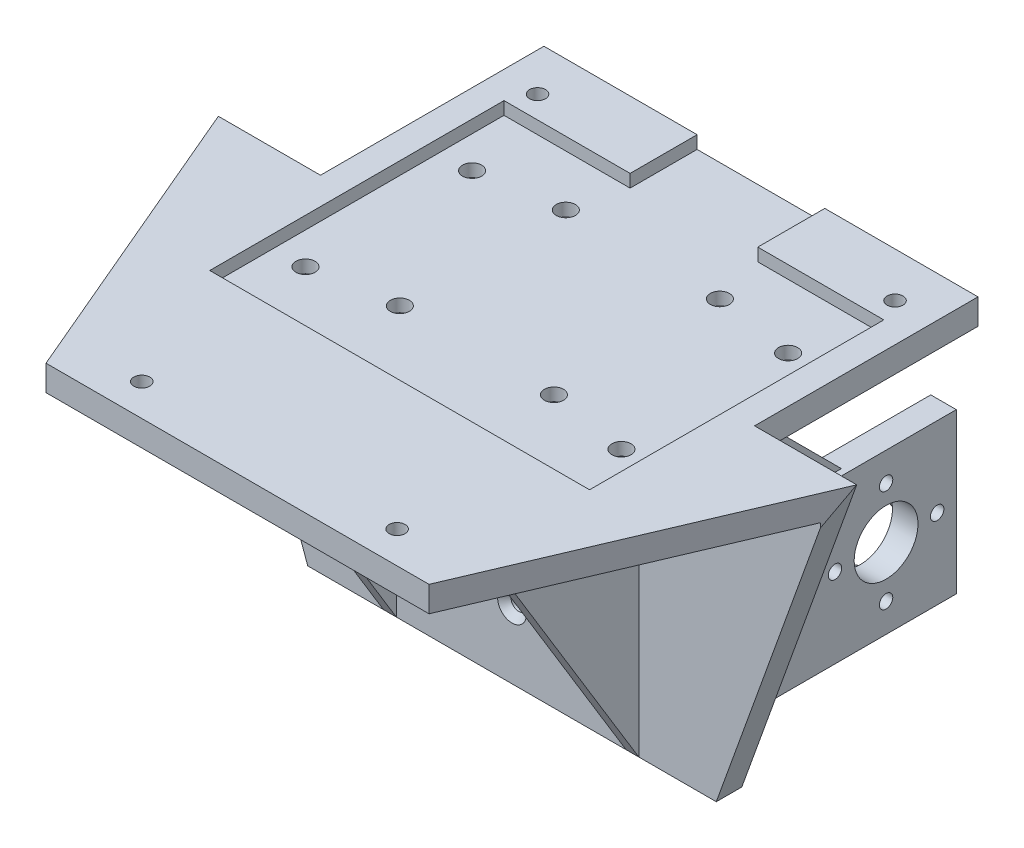
from build123d import *

# Parameters (mm, degrees)
SKETCH_1_W                = 47
SKETCH_1_H                = 50
EXTRUDE_1_DEPTH           = 100
SKETCH_2_W                = 43
SKETCH_2_H                = 46
CUT_EXTRUDE_1_DEPTH       = 122.280666225
HOLE_WIZARD_1_D           = 2.4
HOLE_WIZARD_1_CSINK_D     = 4.5
HOLE_WIZARD_1_CSINK_ANGLE = 90
SKETCH_31_W               = 4
SKETCH_31_H               = 25
EXTRUDE_4_DEPTH           = 37
SKETCH_32_R               = 5
CUT_EXTRUDE_2_DEPTH       = 4
SKETCH_33_R               = 1.9
EXTRUDE_5_DEPTH           = 1.6
SKETCH_34_R               = 1.05
CUT_EXTRUDE_3_DEPTH       = 101.189819842
SKETCH_35_W               = 68
SKETCH_35_H               = 4
EXTRUDE_6_DEPTH           = 35
CUT_EXTRUDE_4_REACH       = 123.281
SKETCH_36_R               = 1.25
CUT_EXTRUDE_5_REACH       = 123.281
CUT_EXTRUDE_6_REACH       = 123.281
SKETCH_39_R               = 2.5
CUT_EXTRUDE_7_DEPTH       = 1.5
CUT_EXTRUDE_8_DEPTH       = 2
CUT_EXTRUDE_9_REACH       = 122.47
SKETCH_41_R               = 1.5
SKETCH_42_R               = 1.5
CUT_EXTRUDE_10_DEPTH      = 2
RIB_2_REACH               = 99.933
SKETCH_46_WALL_W          = 251.717080448
SKETCH_46_WALL_H          = 2
RIB_3_REACH               = 100.118
SKETCH_47_WALL_W          = 252.08841221
SKETCH_47_WALL_H          = 2
SKETCH_48_W               = 2
SKETCH_48_H               = 15
EXTRUDE_7_DEPTH           = 20
CUT_EXTRUDE_11_REACH      = 105.589


with BuildPart() as part:
    # 草图1 → 凸台-拉伸1 (new body)
    with BuildSketch(Plane(origin=(0, 0, 0), x_dir=(0, 0, -1), z_dir=(1, 0, 0))):
        with Locations((-23.5, 25)):
            Rectangle(SKETCH_1_W, SKETCH_1_H)
    extrude(amount=-EXTRUDE_1_DEPTH)

    # 草图2 → 切除-拉伸1 (cut, through all)
    with BuildSketch(Plane(origin=(0, 0, 0), x_dir=(0, 0, -1), z_dir=(1, 0, 0))):
        with Locations((-25.5, 23)):
            Rectangle(SKETCH_2_W, SKETCH_2_H)
    extrude(amount=-CUT_EXTRUDE_1_DEPTH, mode=Mode.SUBTRACT)

    # 打孔尺寸(%根据十字)槽沉头木螺钉的类型1 (through all)
    with Locations(Plane.XY.offset(4)):
        with Locations((-58, 26.5), (-50, 26.5), (-58, 18.5), (-50, 18.5), (-58, 10.5), (-50, 10.5), (-42, 10.5), (-42, 18.5), (-42, 26.5)):
            CounterSinkHole(HOLE_WIZARD_1_D / 2, HOLE_WIZARD_1_CSINK_D / 2, counter_sink_angle=HOLE_WIZARD_1_CSINK_ANGLE)

    # 草图31 → 凸台-拉伸4 (add)
    with BuildSketch(Plane(origin=(0, 0, 0), x_dir=(-1, 0, 0), z_dir=(0, 0, -1))):
        with Locations((23.4, 18.5)):
            Rectangle(SKETCH_31_W, SKETCH_31_H)
    extrude(amount=EXTRUDE_4_DEPTH)

    # 草图32 → 切除-拉伸2 (cut)
    with BuildSketch(Plane.ZY.offset(25.4)):
        with Locations((-26, 18.5)):
            Circle(SKETCH_32_R)
    extrude(amount=-CUT_EXTRUDE_2_DEPTH, mode=Mode.SUBTRACT)

    # 草图33 → 凸台-拉伸5 (add)
    with BuildSketch(Plane.ZY.offset(25.4)):
        with Locations(Location((-26, 26.5, 0), (0, 0, 180))):
            Circle(SKETCH_33_R)
        with Locations(Location((-18, 18.5, 0), (0, 0, 180))):
            Circle(SKETCH_33_R)
        with Locations(Location((-26, 10.5, 0), (0, 0, 180))):
            Circle(SKETCH_33_R)
        with Locations(Location((-34, 18.5, 0), (0, 0, 180))):
            Circle(SKETCH_33_R)
    extrude(amount=EXTRUDE_5_DEPTH)

    # 草图34 → 切除-拉伸3 (cut, through all)
    with BuildSketch(Plane.ZY.offset(27)):
        with Locations((-26, 26.5)):
            Circle(SKETCH_34_R)
        with Locations((-18, 18.5)):
            Circle(SKETCH_34_R)
        with Locations((-26, 10.5)):
            Circle(SKETCH_34_R)
        with Locations((-34, 18.5)):
            Circle(SKETCH_34_R)
    extrude(amount=-CUT_EXTRUDE_3_DEPTH, mode=Mode.SUBTRACT)

    # 草图35 → 凸台-拉伸6 (add)
    with BuildSketch(Plane(origin=(0, 0, 0), x_dir=(-1, 0, 0), z_dir=(0, 0, -1))):
        with Locations((50, 48)):
            Rectangle(SKETCH_35_W, SKETCH_35_H)
    extrude(amount=EXTRUDE_6_DEPTH)

    # 草图36 → 切除-拉伸4 (cut, up to next)
    with BuildSketch(Plane(origin=(0, 50, 0), x_dir=(1, 0, 0), z_dir=(0, 1, 0)), mode=Mode.PRIVATE) as cut_extrude_4_sk1:
        with Locations(Location((-78, 28, 0), (0, 0, 270))):
            Circle(SKETCH_36_R)
    cut_extrude_4_tool1 = extrude(cut_extrude_4_sk1.sketch, amount=-CUT_EXTRUDE_4_REACH, mode=Mode.PRIVATE) & part.part
    # 草图36 → 切除-拉伸4 (cut, up to next)
    with BuildSketch(Plane(origin=(0, 50, 0), x_dir=(1, 0, 0), z_dir=(0, 1, 0)), mode=Mode.PRIVATE) as cut_extrude_4_sk2:
        with Locations(Location((-22, 28, 0), (0, 0, 270))):
            Circle(SKETCH_36_R)
    cut_extrude_4_tool2 = extrude(cut_extrude_4_sk2.sketch, amount=-CUT_EXTRUDE_4_REACH, mode=Mode.PRIVATE) & part.part
    # 草图36 → 切除-拉伸4 (cut, up to next)
    with BuildSketch(Plane(origin=(0, 50, 0), x_dir=(1, 0, 0), z_dir=(0, 1, 0)), mode=Mode.PRIVATE) as cut_extrude_4_sk3:
        with Locations(Location((-70, -42, 0), (0, 0, 270))):
            Circle(SKETCH_36_R)
    cut_extrude_4_tool3 = extrude(cut_extrude_4_sk3.sketch, amount=-CUT_EXTRUDE_4_REACH, mode=Mode.PRIVATE) & part.part
    # 草图36 → 切除-拉伸4 (cut, up to next)
    with BuildSketch(Plane(origin=(0, 50, 0), x_dir=(1, 0, 0), z_dir=(0, 1, 0)), mode=Mode.PRIVATE) as cut_extrude_4_sk4:
        with Locations(Location((-30, -42, 0), (0, 0, 270))):
            Circle(SKETCH_36_R)
    cut_extrude_4_tool4 = extrude(cut_extrude_4_sk4.sketch, amount=-CUT_EXTRUDE_4_REACH, mode=Mode.PRIVATE) & part.part
    add(cut_extrude_4_tool1.solids().sort_by_distance((-78, 50, -28))[0], mode=Mode.SUBTRACT)
    add(cut_extrude_4_tool2.solids().sort_by_distance((-22, 50, -28))[0], mode=Mode.SUBTRACT)
    add(cut_extrude_4_tool3.solids().sort_by_distance((-70, 50, 42))[0], mode=Mode.SUBTRACT)
    add(cut_extrude_4_tool4.solids().sort_by_distance((-30, 50, 42))[0], mode=Mode.SUBTRACT)

    # 草图37 → 切除-拉伸5 (cut, up to next)
    with BuildSketch(Plane(origin=(0, 50, 0), x_dir=(1, 0, 0), z_dir=(0, 1, 0)), mode=Mode.PRIVATE) as cut_extrude_5_sk1:
        Polygon((-100, -47), (-80, -47), (-100, 0), align=None)
    cut_extrude_5_tool1 = extrude(cut_extrude_5_sk1.sketch, amount=-CUT_EXTRUDE_5_REACH, mode=Mode.PRIVATE) & part.part
    # 草图37 → 切除-拉伸5 (cut, up to next)
    with BuildSketch(Plane(origin=(0, 50, 0), x_dir=(1, 0, 0), z_dir=(0, 1, 0)), mode=Mode.PRIVATE) as cut_extrude_5_sk2:
        Polygon((0, -47), (-20, -47), (0, 0), align=None)
    cut_extrude_5_tool2 = extrude(cut_extrude_5_sk2.sketch, amount=-CUT_EXTRUDE_5_REACH, mode=Mode.PRIVATE) & part.part
    add(cut_extrude_5_tool1.solids().sort_by_distance((-93.333333, 50, 31.333333))[0], mode=Mode.SUBTRACT)
    add(cut_extrude_5_tool2.solids().sort_by_distance((-6.666667, 50, 31.333333))[0], mode=Mode.SUBTRACT)

    # 草图38 → 切除-拉伸6 (cut, up to next)
    with BuildSketch(Plane(origin=(0, 0, 0), x_dir=(-1, 0, 0), z_dir=(0, 0, -1)), mode=Mode.PRIVATE) as cut_extrude_6_sk1:
        Polygon((0, 0), (18, 0), (0, 50), align=None)
    cut_extrude_6_tool1 = extrude(cut_extrude_6_sk1.sketch, amount=-CUT_EXTRUDE_6_REACH, mode=Mode.PRIVATE) & part.part
    # 草图38 → 切除-拉伸6 (cut, up to next)
    with BuildSketch(Plane(origin=(0, 0, 0), x_dir=(-1, 0, 0), z_dir=(0, 0, -1)), mode=Mode.PRIVATE) as cut_extrude_6_sk2:
        Polygon((100, 0), (82, 0), (100, 50), align=None)
    cut_extrude_6_tool2 = extrude(cut_extrude_6_sk2.sketch, amount=-CUT_EXTRUDE_6_REACH, mode=Mode.PRIVATE) & part.part
    add(cut_extrude_6_tool1.solids().sort_by_distance((-6, 16.666667, 0))[0], mode=Mode.SUBTRACT)
    add(cut_extrude_6_tool2.solids().sort_by_distance((-94, 16.666667, 0))[0], mode=Mode.SUBTRACT)

    # 草图39 → 切除-拉伸7 (cut)
    with BuildSketch(Plane.XZ.offset(-46)):
        with Locations(Location((-70, 42, 0), (0, 0, 270))):
            Circle(SKETCH_39_R)
        with Locations(Location((-30, 42, 0), (0, 0, 270))):
            Circle(SKETCH_39_R)
        with Locations(Location((-78, -28, 0), (0, 0, 270))):
            Circle(SKETCH_39_R)
        with Locations(Location((-22, -28, 0), (0, 0, 270))):
            Circle(SKETCH_39_R)
    extrude(amount=-CUT_EXTRUDE_7_DEPTH, mode=Mode.SUBTRACT)

    # 草图40 → 切除-拉伸8 (cut)
    with BuildSketch(Plane(origin=(0, 50, 0), x_dir=(1, 0, 0), z_dir=(0, 1, 0))):
        Polygon((-79.75, 24.5), (-60, 24.5), (-60, 35), (-40, 35), (-40, 24.5), (-20.25, 24.5), (-20.25, -21.6), (-79.75, -21.6), align=None)
    extrude(amount=-CUT_EXTRUDE_8_DEPTH, mode=Mode.SUBTRACT)

    # 草图41 → 切除-拉伸9 (cut, up to next)
    with BuildSketch(Plane(origin=(0, 48, 0), x_dir=(1, 0, 0), z_dir=(0, 1, 0)), mode=Mode.PRIVATE) as cut_extrude_9_sk1:
        with Locations(Location((-74.75, 14.5, 0), (0, 0, 270))):
            Circle(SKETCH_41_R)
    cut_extrude_9_tool1 = extrude(cut_extrude_9_sk1.sketch, amount=-CUT_EXTRUDE_9_REACH, mode=Mode.PRIVATE) & part.part
    # 草图41 → 切除-拉伸9 (cut, up to next)
    with BuildSketch(Plane(origin=(0, 48, 0), x_dir=(1, 0, 0), z_dir=(0, 1, 0)), mode=Mode.PRIVATE) as cut_extrude_9_sk2:
        with Locations(Location((-74.75, -11.6, 0), (0, 0, 270))):
            Circle(SKETCH_41_R)
    cut_extrude_9_tool2 = extrude(cut_extrude_9_sk2.sketch, amount=-CUT_EXTRUDE_9_REACH, mode=Mode.PRIVATE) & part.part
    # 草图41 → 切除-拉伸9 (cut, up to next)
    with BuildSketch(Plane(origin=(0, 48, 0), x_dir=(1, 0, 0), z_dir=(0, 1, 0)), mode=Mode.PRIVATE) as cut_extrude_9_sk3:
        with Locations(Location((-25.25, 14.5, 0), (0, 0, 270))):
            Circle(SKETCH_41_R)
    cut_extrude_9_tool3 = extrude(cut_extrude_9_sk3.sketch, amount=-CUT_EXTRUDE_9_REACH, mode=Mode.PRIVATE) & part.part
    # 草图41 → 切除-拉伸9 (cut, up to next)
    with BuildSketch(Plane(origin=(0, 48, 0), x_dir=(1, 0, 0), z_dir=(0, 1, 0)), mode=Mode.PRIVATE) as cut_extrude_9_sk4:
        with Locations(Location((-25.25, -11.6, 0), (0, 0, 270))):
            Circle(SKETCH_41_R)
    cut_extrude_9_tool4 = extrude(cut_extrude_9_sk4.sketch, amount=-CUT_EXTRUDE_9_REACH, mode=Mode.PRIVATE) & part.part
    add(cut_extrude_9_tool1.solids().sort_by_distance((-74.75, 48, -14.5))[0], mode=Mode.SUBTRACT)
    add(cut_extrude_9_tool2.solids().sort_by_distance((-74.75, 48, 11.6))[0], mode=Mode.SUBTRACT)
    add(cut_extrude_9_tool3.solids().sort_by_distance((-25.25, 48, -14.5))[0], mode=Mode.SUBTRACT)
    add(cut_extrude_9_tool4.solids().sort_by_distance((-25.25, 48, 11.6))[0], mode=Mode.SUBTRACT)

    # 草图42 → 切除-拉伸10 (cut)
    with BuildSketch(Plane(origin=(0, 48, 0), x_dir=(1, 0, 0), z_dir=(0, 1, 0))):
        with Locations(Location((-62.07, 16.5, 0), (0, 0, 270))):
            Circle(SKETCH_42_R)
        with Locations(Location((-37.93, 16.5, 0), (0, 0, 270))):
            Circle(SKETCH_42_R)
        with Locations(Location((-37.93, -9.5, 0), (0, 0, 270))):
            Circle(SKETCH_42_R)
        with Locations(Location((-62.07, -9.5, 0), (0, 0, 270))):
            Circle(SKETCH_42_R)
    extrude(amount=-CUT_EXTRUDE_10_DEPTH, mode=Mode.SUBTRACT)

    # 草图46 wall → 筋2 (add, up to next)
    with BuildSketch(Plane(origin=(-30.13, 23, 18), x_dir=(0, -0.854198555614, -0.519946946896), z_dir=(0, 0.519946946896, -0.854198555614)), mode=Mode.PRIVATE) as rib_2_sk1:
        with Locations((0, 1)):
            Rectangle(SKETCH_46_WALL_W, SKETCH_46_WALL_H)
    rib_2_tool1 = extrude(rib_2_sk1.sketch, amount=RIB_2_REACH, mode=Mode.PRIVATE) - part.part
    add(rib_2_tool1.solids().sort_by_distance((-30.13, 23, 18))[0])

    # 草图47 wall → 筋3 (add, up to next)
    with BuildSketch(Plane(origin=(-70.13, 23, 18), x_dir=(0, -0.854198555614, -0.519946946896), z_dir=(0, 0.519946946896, -0.854198555614)), mode=Mode.PRIVATE) as rib_3_sk1:
        with Locations((0, -1)):
            Rectangle(SKETCH_47_WALL_W, SKETCH_47_WALL_H)
    rib_3_tool1 = extrude(rib_3_sk1.sketch, amount=RIB_3_REACH, mode=Mode.PRIVATE) - part.part
    add(rib_3_tool1.solids().sort_by_distance((-70.13, 23, 18))[0])

    # 草图48 → 凸台-拉伸7 (add)
    with BuildSketch(Plane(origin=(0, 0, 0), x_dir=(-1, 0, 0), z_dir=(0, 0, -1))):
        with Locations((23.4, 38.5)):
            Rectangle(SKETCH_48_W, SKETCH_48_H)
    extrude(amount=EXTRUDE_7_DEPTH)

    # 草图49 → 切除-拉伸11 (cut, up to next)
    with BuildSketch(Plane(origin=(-22.4, 0, 0), x_dir=(0, 0, -1), z_dir=(1, 0, 0)), mode=Mode.PRIVATE) as cut_extrude_11_sk1:
        Polygon((5, 46), (20, 46), (20, 31), align=None)
    cut_extrude_11_tool1 = extrude(cut_extrude_11_sk1.sketch, amount=-CUT_EXTRUDE_11_REACH, mode=Mode.PRIVATE) & part.part
    add(cut_extrude_11_tool1.solids().sort_by_distance((-22.4, 41, -15))[0], mode=Mode.SUBTRACT)


solid = part.part
